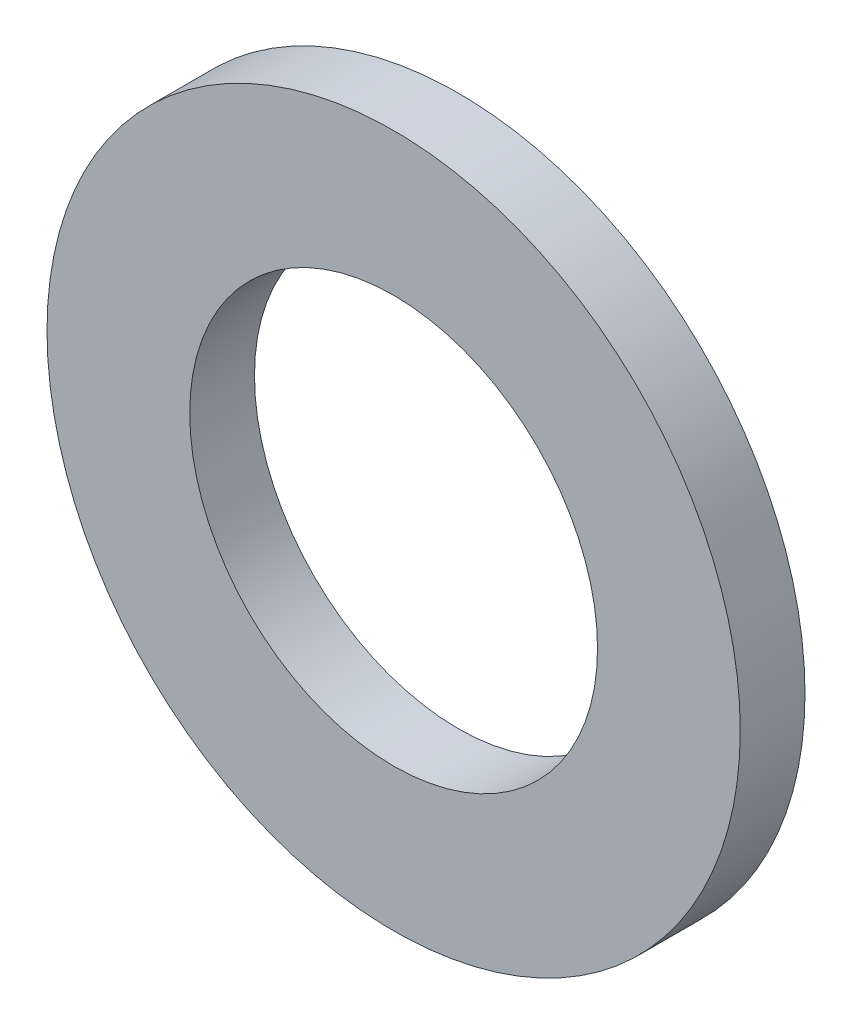
from build123d import *

# Parameters (mm, degrees)
SKETCH1_R           = 8.5
SKETCH1_R_2         = 5
BOSS_EXTRUDE1_DEPTH = 1.5875


with BuildPart() as part:
    # Sketch1 → Boss-Extrude1 (new body)
    with BuildSketch(Plane.XY):
        Circle(SKETCH1_R)
        Circle(SKETCH1_R_2, mode=Mode.SUBTRACT)
    extrude(amount=BOSS_EXTRUDE1_DEPTH)


solid = part.part
